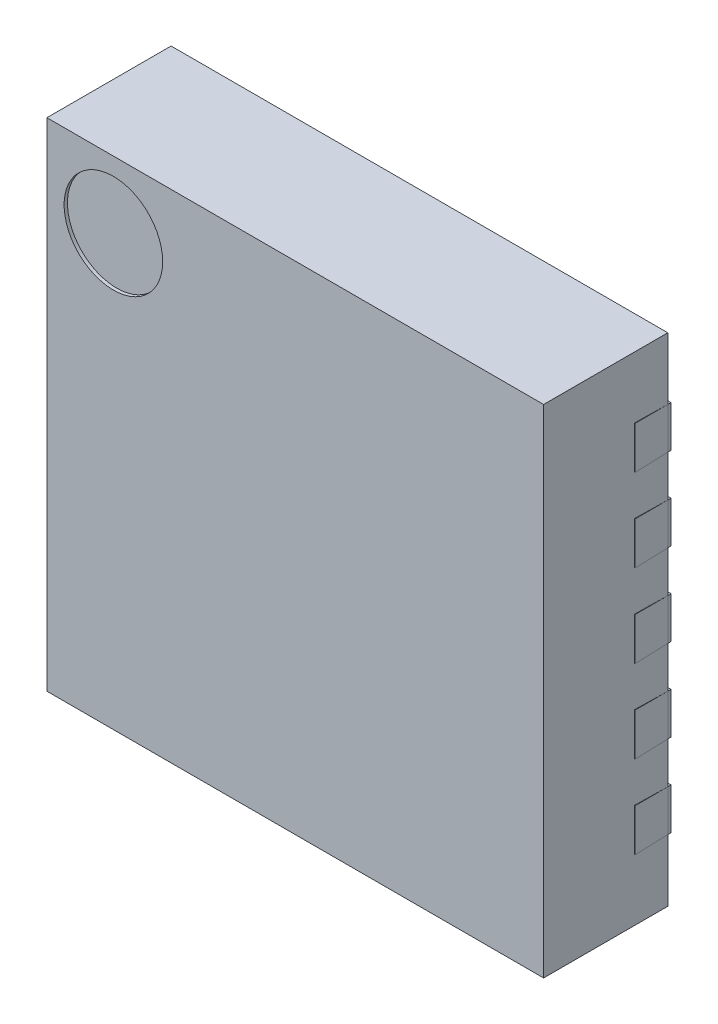
from build123d import *

# Parameters (mm, degrees)
SKETCH1_W                     = 3
SKETCH1_H                     = 3
BOSS_EXTRUDE1_DEPTH           = 0.75
SKETCH2_R                     = 0.297554852
CUT_EXTRUDE1_DEPTH            = 0.02
BOSS_EXTRUDE2_DEPTH           = 0.02
BOSS_EXTRUDE3_DEPTH           = 0.02
BOSS_EXTRUDE3_OTHER_WAY_DEPTH = 0.2
BOSS_EXTRUDE3_OTHER_WAY_DRAFT = 1
LPATTERN2_COUNT               = 3
LPATTERN2_PITCH               = 0.5
LPATTERN2_COPY_1_DEPTH        = 0.2
LPATTERN2_COPY_1_DRAFT        = 1
LPATTERN2_COPY_2_DEPTH        = 0.2
LPATTERN2_COPY_2_DRAFT        = 1
LPATTERN2_COPY_3_DEPTH        = 0.2
LPATTERN2_COPY_3_DRAFT        = 1
LPATTERN2_COPY_4_DEPTH        = 0.2
LPATTERN2_COPY_4_DRAFT        = 1
LPATTERN2_COL_COUNT           = 3
LPATTERN2_COL_PITCH           = 0.5
LPATTERN2_COL_COPY_1_DEPTH    = 0.2
LPATTERN2_COL_COPY_1_DRAFT    = 1
LPATTERN2_COL_COPY_2_DEPTH    = 0.2
LPATTERN2_COL_COPY_2_DRAFT    = 1
LPATTERN2_COL_COPY_3_DEPTH    = 0.2
LPATTERN2_COL_COPY_3_DRAFT    = 1
LPATTERN2_COL_COPY_4_DEPTH    = 0.2
LPATTERN2_COL_COPY_4_DRAFT    = 1
MIRROR1_COPY_1_DEPTH          = 0.2
MIRROR1_COPY_1_DRAFT          = 1
MIRROR1_COPY_2_DEPTH          = 0.2
MIRROR1_COPY_2_DRAFT          = 1
MIRROR1_COPY_3_DEPTH          = 0.02
MIRROR1_COPY_4_DEPTH          = 0.02
MIRROR1_COPY_5_DEPTH          = 0.2
MIRROR1_COPY_5_DRAFT          = 1
MIRROR1_COPY_6_DEPTH          = 0.2
MIRROR1_COPY_6_DRAFT          = 1
MIRROR1_COPY_7_DEPTH          = 0.2
MIRROR1_COPY_7_DRAFT          = 1
MIRROR1_COPY_8_DEPTH          = 0.2
MIRROR1_COPY_8_DRAFT          = 1
MIRROR1_COPY_9_DEPTH          = 0.02
MIRROR1_COPY_10_DEPTH         = 0.02
MIRROR1_COPY_11_DEPTH         = 0.2
MIRROR1_COPY_11_DRAFT         = 1
MIRROR1_COPY_12_DEPTH         = 0.2
MIRROR1_COPY_12_DRAFT         = 1
MIRROR1_COPY_13_DEPTH         = 0.2
MIRROR1_COPY_13_DRAFT         = 1
MIRROR1_COPY_14_DEPTH         = 0.2
MIRROR1_COPY_14_DRAFT         = 1
MIRROR1_COPY_15_DEPTH         = 0.2
MIRROR1_COPY_15_DRAFT         = 1


with BuildPart() as part:
    # Sketch1 → Boss-Extrude1 (new body)
    with BuildSketch(Plane.XY):
        Rectangle(SKETCH1_W, SKETCH1_H)
    extrude(amount=BOSS_EXTRUDE1_DEPTH)

    # Sketch2 → Cut-Extrude1 (cut)
    with BuildSketch(Plane.XY.offset(0.75)):
        with Locations((-1.098438597, 1.096593323)):
            Circle(SKETCH2_R)
    extrude(amount=-CUT_EXTRUDE1_DEPTH, mode=Mode.SUBTRACT)

    # Sketch3 → Boss-Extrude2 (add)
    with BuildSketch(Plane(origin=(0, 0, 0), x_dir=(-1, 0, 0), z_dir=(0, 0, -1))):
        Polygon((0.825, 1.007619321), (0.642619321, 1.19), (-0.825, 1.19), (-0.825, -1.19), (0.825, -1.19), align=None)
    extrude(amount=BOSS_EXTRUDE2_DEPTH)

    # Sketch4 → Boss-Extrude3 (add)
    with BuildSketch(Plane(origin=(0, 0, 0), x_dir=(-1, 0, 0), z_dir=(0, 0, -1))):
        with BuildLine():
            Line((-1.5, 0.125), (-1.5, -0.125))
            Line((-1.5, -0.125), (-1.245, -0.125))
            ThreePointArc((-1.245, -0.125), (-1.12, 0), (-1.245, 0.125))
            Line((-1.245, 0.125), (-1.5, 0.125))
        make_face()
    boss_extrude3 = extrude(amount=BOSS_EXTRUDE3_DEPTH)


with BuildPart() as boss_extrude3_other_way_tool:
    # Sketch4 → Boss-Extrude3 other way (with draft: the straight prism first)
    with BuildSketch(Plane(origin=(0, 0, 0), x_dir=(-1, 0, 0), z_dir=(0, 0, -1))):
        with BuildLine():
            Line((-1.5, 0.125), (-1.5, -0.125))
            Line((-1.5, -0.125), (-1.245, -0.125))
            ThreePointArc((-1.245, -0.125), (-1.12, 0), (-1.245, 0.125))
            Line((-1.245, 0.125), (-1.5, 0.125))
        make_face()
    extrude(amount=-BOSS_EXTRUDE3_OTHER_WAY_DEPTH)
    # Boss-Extrude3 other way: the draft: its side faces are tilted about the plane it starts from
    boss_extrude3_other_way_sides = [boss_extrude3_other_way_tool.faces().sort_by_distance(p)[0] for p in [
        (1.3725, 0.125, 0.1),
        (1.5, 0, 0.1),
        (1.3725, -0.125, 0.1),
        (1.12, 0, 0.1),
    ]]
    draft(boss_extrude3_other_way_sides, Plane(origin=(0, 0, 0), x_dir=(-1, 0, 0), z_dir=(0, 0, -1)), BOSS_EXTRUDE3_OTHER_WAY_DRAFT)


with BuildPart() as part_1:
    add(part.part)

    # Boss-Extrude3 other way: add boss_extrude3_other_way_tool
    add(boss_extrude3_other_way_tool.part)

    # LPattern2: Boss-Extrude3 ×3
    with Locations(*[(0, i * LPATTERN2_PITCH, 0) for i in range(1, LPATTERN2_COUNT)]):
        add(boss_extrude3)


with BuildPart() as lpattern2_copy_1_tool:
    # LPattern2 copy 1 sketch → LPattern2 copy 1 (with draft: the straight prism first)
    with BuildSketch(Plane(origin=(0, 0.5, 0), x_dir=(-1, 0, 0), z_dir=(0, 0, -1))):
        with BuildLine():
            Line((-1.5, 0.125), (-1.5, -0.125))
            Line((-1.5, -0.125), (-1.245, -0.125))
            ThreePointArc((-1.245, -0.125), (-1.12, 0), (-1.245, 0.125))
            Line((-1.245, 0.125), (-1.5, 0.125))
        make_face()
    extrude(amount=-LPATTERN2_COPY_1_DEPTH)
    # LPattern2 copy 1: the draft: its side faces are tilted about the plane it starts from
    lpattern2_copy_1_sides = [lpattern2_copy_1_tool.faces().sort_by_distance(p)[0] for p in [
        (1.3725, 0.625, 0.1),
        (1.5, 0.5, 0.1),
        (1.3725, 0.375, 0.1),
        (1.12, 0.5, 0.1),
    ]]
    draft(lpattern2_copy_1_sides, Plane(origin=(0, 0.5, 0), x_dir=(-1, 0, 0), z_dir=(0, 0, -1)), LPATTERN2_COPY_1_DRAFT)


with BuildPart() as part_2:
    add(part_1.part)

    # LPattern2 copy 1: add lpattern2_copy_1_tool
    add(lpattern2_copy_1_tool.part)


with BuildPart() as lpattern2_copy_2_tool:
    # LPattern2 copy 2 sketch → LPattern2 copy 2 (with draft: the straight prism first)
    with BuildSketch(Plane(origin=(0, 1, 0), x_dir=(-1, 0, 0), z_dir=(0, 0, -1))):
        with BuildLine():
            Line((-1.5, 0.125), (-1.5, -0.125))
            Line((-1.5, -0.125), (-1.245, -0.125))
            ThreePointArc((-1.245, -0.125), (-1.12, 0), (-1.245, 0.125))
            Line((-1.245, 0.125), (-1.5, 0.125))
        make_face()
    extrude(amount=-LPATTERN2_COPY_2_DEPTH)
    # LPattern2 copy 2: the draft: its side faces are tilted about the plane it starts from
    lpattern2_copy_2_sides = [lpattern2_copy_2_tool.faces().sort_by_distance(p)[0] for p in [
        (1.3725, 1.125, 0.1),
        (1.5, 1, 0.1),
        (1.3725, 0.875, 0.1),
        (1.12, 1, 0.1),
    ]]
    draft(lpattern2_copy_2_sides, Plane(origin=(0, 1, 0), x_dir=(-1, 0, 0), z_dir=(0, 0, -1)), LPATTERN2_COPY_2_DRAFT)


with BuildPart() as part_3:
    add(part_2.part)

    # LPattern2 copy 2: add lpattern2_copy_2_tool
    add(lpattern2_copy_2_tool.part)


with BuildPart() as lpattern2_copy_3_tool:
    # LPattern2 copy 3 sketch → LPattern2 copy 3 (with draft: the straight prism first)
    with BuildSketch(Plane(origin=(0, 0.5, 0), x_dir=(-1, 0, 0), z_dir=(0, 0, -1))):
        with BuildLine():
            Line((-1.5, 0.125), (-1.5, -0.125))
            Line((-1.5, -0.125), (-1.245, -0.125))
            ThreePointArc((-1.245, -0.125), (-1.12, 0), (-1.245, 0.125))
            Line((-1.245, 0.125), (-1.5, 0.125))
        make_face()
    extrude(amount=-LPATTERN2_COPY_3_DEPTH)
    # LPattern2 copy 3: the draft: its side faces are tilted about the plane it starts from
    lpattern2_copy_3_sides = [lpattern2_copy_3_tool.faces().sort_by_distance(p)[0] for p in [
        (1.3725, 0.625, 0.1),
        (1.5, 0.5, 0.1),
        (1.3725, 0.375, 0.1),
        (1.12, 0.5, 0.1),
    ]]
    draft(lpattern2_copy_3_sides, Plane(origin=(0, 0.5, 0), x_dir=(-1, 0, 0), z_dir=(0, 0, -1)), LPATTERN2_COPY_3_DRAFT)


with BuildPart() as part_4:
    add(part_3.part)

    # LPattern2 copy 3: add lpattern2_copy_3_tool
    add(lpattern2_copy_3_tool.part)


with BuildPart() as lpattern2_copy_4_tool:
    # LPattern2 copy 4 sketch → LPattern2 copy 4 (with draft: the straight prism first)
    with BuildSketch(Plane(origin=(0, 1, 0), x_dir=(-1, 0, 0), z_dir=(0, 0, -1))):
        with BuildLine():
            Line((-1.5, 0.125), (-1.5, -0.125))
            Line((-1.5, -0.125), (-1.245, -0.125))
            ThreePointArc((-1.245, -0.125), (-1.12, 0), (-1.245, 0.125))
            Line((-1.245, 0.125), (-1.5, 0.125))
        make_face()
    extrude(amount=-LPATTERN2_COPY_4_DEPTH)
    # LPattern2 copy 4: the draft: its side faces are tilted about the plane it starts from
    lpattern2_copy_4_sides = [lpattern2_copy_4_tool.faces().sort_by_distance(p)[0] for p in [
        (1.3725, 1.125, 0.1),
        (1.5, 1, 0.1),
        (1.3725, 0.875, 0.1),
        (1.12, 1, 0.1),
    ]]
    draft(lpattern2_copy_4_sides, Plane(origin=(0, 1, 0), x_dir=(-1, 0, 0), z_dir=(0, 0, -1)), LPATTERN2_COPY_4_DRAFT)


with BuildPart() as part_5:
    add(part_4.part)

    # LPattern2 copy 4: add lpattern2_copy_4_tool
    add(lpattern2_copy_4_tool.part)

    # LPattern2 col: Boss-Extrude3 ×3
    with Locations(*[(0, -i * LPATTERN2_COL_PITCH, 0) for i in range(1, LPATTERN2_COL_COUNT)]):
        add(boss_extrude3)


with BuildPart() as lpattern2_col_copy_1_tool:
    # LPattern2 col copy 1 sketch → LPattern2 col copy 1 (with draft: the straight prism first)
    with BuildSketch(Plane(origin=(0, -0.5, 0), x_dir=(-1, 0, 0), z_dir=(0, 0, -1))):
        with BuildLine():
            Line((-1.5, 0.125), (-1.5, -0.125))
            Line((-1.5, -0.125), (-1.245, -0.125))
            ThreePointArc((-1.245, -0.125), (-1.12, 0), (-1.245, 0.125))
            Line((-1.245, 0.125), (-1.5, 0.125))
        make_face()
    extrude(amount=-LPATTERN2_COL_COPY_1_DEPTH)
    # LPattern2 col copy 1: the draft: its side faces are tilted about the plane it starts from
    lpattern2_col_copy_1_sides = [lpattern2_col_copy_1_tool.faces().sort_by_distance(p)[0] for p in [
        (1.3725, -0.375, 0.1),
        (1.5, -0.5, 0.1),
        (1.3725, -0.625, 0.1),
        (1.12, -0.5, 0.1),
    ]]
    draft(lpattern2_col_copy_1_sides, Plane(origin=(0, -0.5, 0), x_dir=(-1, 0, 0), z_dir=(0, 0, -1)), LPATTERN2_COL_COPY_1_DRAFT)


with BuildPart() as part_6:
    add(part_5.part)

    # LPattern2 col copy 1: add lpattern2_col_copy_1_tool
    add(lpattern2_col_copy_1_tool.part)


with BuildPart() as lpattern2_col_copy_2_tool:
    # LPattern2 col copy 2 sketch → LPattern2 col copy 2 (with draft: the straight prism first)
    with BuildSketch(Plane(origin=(0, -1, 0), x_dir=(-1, 0, 0), z_dir=(0, 0, -1))):
        with BuildLine():
            Line((-1.5, 0.125), (-1.5, -0.125))
            Line((-1.5, -0.125), (-1.245, -0.125))
            ThreePointArc((-1.245, -0.125), (-1.12, 0), (-1.245, 0.125))
            Line((-1.245, 0.125), (-1.5, 0.125))
        make_face()
    extrude(amount=-LPATTERN2_COL_COPY_2_DEPTH)
    # LPattern2 col copy 2: the draft: its side faces are tilted about the plane it starts from
    lpattern2_col_copy_2_sides = [lpattern2_col_copy_2_tool.faces().sort_by_distance(p)[0] for p in [
        (1.3725, -0.875, 0.1),
        (1.5, -1, 0.1),
        (1.3725, -1.125, 0.1),
        (1.12, -1, 0.1),
    ]]
    draft(lpattern2_col_copy_2_sides, Plane(origin=(0, -1, 0), x_dir=(-1, 0, 0), z_dir=(0, 0, -1)), LPATTERN2_COL_COPY_2_DRAFT)


with BuildPart() as part_7:
    add(part_6.part)

    # LPattern2 col copy 2: add lpattern2_col_copy_2_tool
    add(lpattern2_col_copy_2_tool.part)


with BuildPart() as lpattern2_col_copy_3_tool:
    # LPattern2 col copy 3 sketch → LPattern2 col copy 3 (with draft: the straight prism first)
    with BuildSketch(Plane(origin=(0, -0.5, 0), x_dir=(-1, 0, 0), z_dir=(0, 0, -1))):
        with BuildLine():
            Line((-1.5, 0.125), (-1.5, -0.125))
            Line((-1.5, -0.125), (-1.245, -0.125))
            ThreePointArc((-1.245, -0.125), (-1.12, 0), (-1.245, 0.125))
            Line((-1.245, 0.125), (-1.5, 0.125))
        make_face()
    extrude(amount=-LPATTERN2_COL_COPY_3_DEPTH)
    # LPattern2 col copy 3: the draft: its side faces are tilted about the plane it starts from
    lpattern2_col_copy_3_sides = [lpattern2_col_copy_3_tool.faces().sort_by_distance(p)[0] for p in [
        (1.3725, -0.375, 0.1),
        (1.5, -0.5, 0.1),
        (1.3725, -0.625, 0.1),
        (1.12, -0.5, 0.1),
    ]]
    draft(lpattern2_col_copy_3_sides, Plane(origin=(0, -0.5, 0), x_dir=(-1, 0, 0), z_dir=(0, 0, -1)), LPATTERN2_COL_COPY_3_DRAFT)


with BuildPart() as part_8:
    add(part_7.part)

    # LPattern2 col copy 3: add lpattern2_col_copy_3_tool
    add(lpattern2_col_copy_3_tool.part)


with BuildPart() as lpattern2_col_copy_4_tool:
    # LPattern2 col copy 4 sketch → LPattern2 col copy 4 (with draft: the straight prism first)
    with BuildSketch(Plane(origin=(0, -1, 0), x_dir=(-1, 0, 0), z_dir=(0, 0, -1))):
        with BuildLine():
            Line((-1.5, 0.125), (-1.5, -0.125))
            Line((-1.5, -0.125), (-1.245, -0.125))
            ThreePointArc((-1.245, -0.125), (-1.12, 0), (-1.245, 0.125))
            Line((-1.245, 0.125), (-1.5, 0.125))
        make_face()
    extrude(amount=-LPATTERN2_COL_COPY_4_DEPTH)
    # LPattern2 col copy 4: the draft: its side faces are tilted about the plane it starts from
    lpattern2_col_copy_4_sides = [lpattern2_col_copy_4_tool.faces().sort_by_distance(p)[0] for p in [
        (1.3725, -0.875, 0.1),
        (1.5, -1, 0.1),
        (1.3725, -1.125, 0.1),
        (1.12, -1, 0.1),
    ]]
    draft(lpattern2_col_copy_4_sides, Plane(origin=(0, -1, 0), x_dir=(-1, 0, 0), z_dir=(0, 0, -1)), LPATTERN2_COL_COPY_4_DRAFT)


with BuildPart() as part_9:
    add(part_8.part)

    # LPattern2 col copy 4: add lpattern2_col_copy_4_tool
    add(lpattern2_col_copy_4_tool.part)

    # Mirror1: Boss-Extrude3 across plane
    add(boss_extrude3.mirror(Plane(origin=(0, 0, 0), x_dir=(0, 0, 1), z_dir=(1, 0, 0))))


with BuildPart() as mirror1_copy_1_tool:
    # Mirror1 copy 1 sketch → Mirror1 copy 1 (with draft: the straight prism first)
    with BuildSketch(Plane(origin=(0, 0, 0), x_dir=(1, 0, 0), z_dir=(0, 0, -1))):
        with BuildLine():
            Line((-1.5, -0.125), (-1.5, 0.125))
            Line((-1.5, 0.125), (-1.245, 0.125))
            ThreePointArc((-1.245, 0.125), (-1.12, 0), (-1.245, -0.125))
            Line((-1.245, -0.125), (-1.5, -0.125))
        make_face()
    extrude(amount=-MIRROR1_COPY_1_DEPTH)
    # Mirror1 copy 1: the draft: its side faces are tilted about the plane it starts from
    mirror1_copy_1_sides = [mirror1_copy_1_tool.faces().sort_by_distance(p)[0] for p in [
        (-1.3725, 0.125, 0.1),
        (-1.5, 0, 0.1),
        (-1.3725, -0.125, 0.1),
        (-1.12, 0, 0.1),
    ]]
    draft(mirror1_copy_1_sides, Plane(origin=(0, 0, 0), x_dir=(1, 0, 0), z_dir=(0, 0, -1)), MIRROR1_COPY_1_DRAFT)


with BuildPart() as part_10:
    add(part_9.part)

    # Mirror1 copy 1: add mirror1_copy_1_tool
    add(mirror1_copy_1_tool.part)


with BuildPart() as mirror1_copy_2_tool:
    # Mirror1 copy 2 sketch → Mirror1 copy 2 (with draft: the straight prism first)
    with BuildSketch(Plane(origin=(0, 0, 0), x_dir=(1, 0, 0), z_dir=(0, 0, -1))):
        with BuildLine():
            Line((-1.5, -0.125), (-1.5, 0.125))
            Line((-1.5, 0.125), (-1.245, 0.125))
            ThreePointArc((-1.245, 0.125), (-1.12, 0), (-1.245, -0.125))
            Line((-1.245, -0.125), (-1.5, -0.125))
        make_face()
    extrude(amount=-MIRROR1_COPY_2_DEPTH)
    # Mirror1 copy 2: the draft: its side faces are tilted about the plane it starts from
    mirror1_copy_2_sides = [mirror1_copy_2_tool.faces().sort_by_distance(p)[0] for p in [
        (-1.3725, 0.125, 0.1),
        (-1.5, 0, 0.1),
        (-1.3725, -0.125, 0.1),
        (-1.12, 0, 0.1),
    ]]
    draft(mirror1_copy_2_sides, Plane(origin=(0, 0, 0), x_dir=(1, 0, 0), z_dir=(0, 0, -1)), MIRROR1_COPY_2_DRAFT)


with BuildPart() as part_11:
    add(part_10.part)

    # Mirror1 copy 2: add mirror1_copy_2_tool
    add(mirror1_copy_2_tool.part)

    # Mirror1 copy 3 sketch → Mirror1 copy 3 (add)
    with BuildSketch(Plane(origin=(0, 0.5, 0), x_dir=(1, 0, 0), z_dir=(0, 0, -1))):
        with BuildLine():
            Line((-1.5, -0.125), (-1.5, 0.125))
            Line((-1.5, 0.125), (-1.245, 0.125))
            ThreePointArc((-1.245, 0.125), (-1.12, 0), (-1.245, -0.125))
            Line((-1.245, -0.125), (-1.5, -0.125))
        make_face()
    extrude(amount=MIRROR1_COPY_3_DEPTH)

    # Mirror1 copy 4 sketch → Mirror1 copy 4 (add)
    with BuildSketch(Plane(origin=(0, 1, 0), x_dir=(1, 0, 0), z_dir=(0, 0, -1))):
        with BuildLine():
            Line((-1.5, -0.125), (-1.5, 0.125))
            Line((-1.5, 0.125), (-1.245, 0.125))
            ThreePointArc((-1.245, 0.125), (-1.12, 0), (-1.245, -0.125))
            Line((-1.245, -0.125), (-1.5, -0.125))
        make_face()
    extrude(amount=MIRROR1_COPY_4_DEPTH)


with BuildPart() as mirror1_copy_5_tool:
    # Mirror1 copy 5 sketch → Mirror1 copy 5 (with draft: the straight prism first)
    with BuildSketch(Plane(origin=(0, 0.5, 0), x_dir=(1, 0, 0), z_dir=(0, 0, -1))):
        with BuildLine():
            Line((-1.5, -0.125), (-1.5, 0.125))
            Line((-1.5, 0.125), (-1.245, 0.125))
            ThreePointArc((-1.245, 0.125), (-1.12, 0), (-1.245, -0.125))
            Line((-1.245, -0.125), (-1.5, -0.125))
        make_face()
    extrude(amount=-MIRROR1_COPY_5_DEPTH)
    # Mirror1 copy 5: the draft: its side faces are tilted about the plane it starts from
    mirror1_copy_5_sides = [mirror1_copy_5_tool.faces().sort_by_distance(p)[0] for p in [
        (-1.3725, 0.625, 0.1),
        (-1.5, 0.5, 0.1),
        (-1.3725, 0.375, 0.1),
        (-1.12, 0.5, 0.1),
    ]]
    draft(mirror1_copy_5_sides, Plane(origin=(0, 0.5, 0), x_dir=(1, 0, 0), z_dir=(0, 0, -1)), MIRROR1_COPY_5_DRAFT)


with BuildPart() as part_12:
    add(part_11.part)

    # Mirror1 copy 5: add mirror1_copy_5_tool
    add(mirror1_copy_5_tool.part)


with BuildPart() as mirror1_copy_6_tool:
    # Mirror1 copy 6 sketch → Mirror1 copy 6 (with draft: the straight prism first)
    with BuildSketch(Plane(origin=(0, 1, 0), x_dir=(1, 0, 0), z_dir=(0, 0, -1))):
        with BuildLine():
            Line((-1.5, -0.125), (-1.5, 0.125))
            Line((-1.5, 0.125), (-1.245, 0.125))
            ThreePointArc((-1.245, 0.125), (-1.12, 0), (-1.245, -0.125))
            Line((-1.245, -0.125), (-1.5, -0.125))
        make_face()
    extrude(amount=-MIRROR1_COPY_6_DEPTH)
    # Mirror1 copy 6: the draft: its side faces are tilted about the plane it starts from
    mirror1_copy_6_sides = [mirror1_copy_6_tool.faces().sort_by_distance(p)[0] for p in [
        (-1.3725, 1.125, 0.1),
        (-1.5, 1, 0.1),
        (-1.3725, 0.875, 0.1),
        (-1.12, 1, 0.1),
    ]]
    draft(mirror1_copy_6_sides, Plane(origin=(0, 1, 0), x_dir=(1, 0, 0), z_dir=(0, 0, -1)), MIRROR1_COPY_6_DRAFT)


with BuildPart() as part_13:
    add(part_12.part)

    # Mirror1 copy 6: add mirror1_copy_6_tool
    add(mirror1_copy_6_tool.part)


with BuildPart() as mirror1_copy_7_tool:
    # Mirror1 copy 7 sketch → Mirror1 copy 7 (with draft: the straight prism first)
    with BuildSketch(Plane(origin=(0, 0.5, 0), x_dir=(1, 0, 0), z_dir=(0, 0, -1))):
        with BuildLine():
            Line((-1.5, -0.125), (-1.5, 0.125))
            Line((-1.5, 0.125), (-1.245, 0.125))
            ThreePointArc((-1.245, 0.125), (-1.12, 0), (-1.245, -0.125))
            Line((-1.245, -0.125), (-1.5, -0.125))
        make_face()
    extrude(amount=-MIRROR1_COPY_7_DEPTH)
    # Mirror1 copy 7: the draft: its side faces are tilted about the plane it starts from
    mirror1_copy_7_sides = [mirror1_copy_7_tool.faces().sort_by_distance(p)[0] for p in [
        (-1.3725, 0.625, 0.1),
        (-1.5, 0.5, 0.1),
        (-1.3725, 0.375, 0.1),
        (-1.12, 0.5, 0.1),
    ]]
    draft(mirror1_copy_7_sides, Plane(origin=(0, 0.5, 0), x_dir=(1, 0, 0), z_dir=(0, 0, -1)), MIRROR1_COPY_7_DRAFT)


with BuildPart() as part_14:
    add(part_13.part)

    # Mirror1 copy 7: add mirror1_copy_7_tool
    add(mirror1_copy_7_tool.part)


with BuildPart() as mirror1_copy_8_tool:
    # Mirror1 copy 8 sketch → Mirror1 copy 8 (with draft: the straight prism first)
    with BuildSketch(Plane(origin=(0, 1, 0), x_dir=(1, 0, 0), z_dir=(0, 0, -1))):
        with BuildLine():
            Line((-1.5, -0.125), (-1.5, 0.125))
            Line((-1.5, 0.125), (-1.245, 0.125))
            ThreePointArc((-1.245, 0.125), (-1.12, 0), (-1.245, -0.125))
            Line((-1.245, -0.125), (-1.5, -0.125))
        make_face()
    extrude(amount=-MIRROR1_COPY_8_DEPTH)
    # Mirror1 copy 8: the draft: its side faces are tilted about the plane it starts from
    mirror1_copy_8_sides = [mirror1_copy_8_tool.faces().sort_by_distance(p)[0] for p in [
        (-1.3725, 1.125, 0.1),
        (-1.5, 1, 0.1),
        (-1.3725, 0.875, 0.1),
        (-1.12, 1, 0.1),
    ]]
    draft(mirror1_copy_8_sides, Plane(origin=(0, 1, 0), x_dir=(1, 0, 0), z_dir=(0, 0, -1)), MIRROR1_COPY_8_DRAFT)


with BuildPart() as part_15:
    add(part_14.part)

    # Mirror1 copy 8: add mirror1_copy_8_tool
    add(mirror1_copy_8_tool.part)

    # Mirror1 copy 9 sketch → Mirror1 copy 9 (add)
    with BuildSketch(Plane(origin=(0, -0.5, 0), x_dir=(1, 0, 0), z_dir=(0, 0, -1))):
        with BuildLine():
            Line((-1.5, -0.125), (-1.5, 0.125))
            Line((-1.5, 0.125), (-1.245, 0.125))
            ThreePointArc((-1.245, 0.125), (-1.12, 0), (-1.245, -0.125))
            Line((-1.245, -0.125), (-1.5, -0.125))
        make_face()
    extrude(amount=MIRROR1_COPY_9_DEPTH)

    # Mirror1 copy 10 sketch → Mirror1 copy 10 (add)
    with BuildSketch(Plane(origin=(0, -1, 0), x_dir=(1, 0, 0), z_dir=(0, 0, -1))):
        with BuildLine():
            Line((-1.5, -0.125), (-1.5, 0.125))
            Line((-1.5, 0.125), (-1.245, 0.125))
            ThreePointArc((-1.245, 0.125), (-1.12, 0), (-1.245, -0.125))
            Line((-1.245, -0.125), (-1.5, -0.125))
        make_face()
    extrude(amount=MIRROR1_COPY_10_DEPTH)


with BuildPart() as mirror1_copy_11_tool:
    # Mirror1 copy 11 sketch → Mirror1 copy 11 (with draft: the straight prism first)
    with BuildSketch(Plane(origin=(0, -0.5, 0), x_dir=(1, 0, 0), z_dir=(0, 0, -1))):
        with BuildLine():
            Line((-1.5, -0.125), (-1.5, 0.125))
            Line((-1.5, 0.125), (-1.245, 0.125))
            ThreePointArc((-1.245, 0.125), (-1.12, 0), (-1.245, -0.125))
            Line((-1.245, -0.125), (-1.5, -0.125))
        make_face()
    extrude(amount=-MIRROR1_COPY_11_DEPTH)
    # Mirror1 copy 11: the draft: its side faces are tilted about the plane it starts from
    mirror1_copy_11_sides = [mirror1_copy_11_tool.faces().sort_by_distance(p)[0] for p in [
        (-1.3725, -0.375, 0.1),
        (-1.5, -0.5, 0.1),
        (-1.3725, -0.625, 0.1),
        (-1.12, -0.5, 0.1),
    ]]
    draft(mirror1_copy_11_sides, Plane(origin=(0, -0.5, 0), x_dir=(1, 0, 0), z_dir=(0, 0, -1)), MIRROR1_COPY_11_DRAFT)


with BuildPart() as part_16:
    add(part_15.part)

    # Mirror1 copy 11: add mirror1_copy_11_tool
    add(mirror1_copy_11_tool.part)


with BuildPart() as mirror1_copy_12_tool:
    # Mirror1 copy 12 sketch → Mirror1 copy 12 (with draft: the straight prism first)
    with BuildSketch(Plane(origin=(0, -1, 0), x_dir=(1, 0, 0), z_dir=(0, 0, -1))):
        with BuildLine():
            Line((-1.5, -0.125), (-1.5, 0.125))
            Line((-1.5, 0.125), (-1.245, 0.125))
            ThreePointArc((-1.245, 0.125), (-1.12, 0), (-1.245, -0.125))
            Line((-1.245, -0.125), (-1.5, -0.125))
        make_face()
    extrude(amount=-MIRROR1_COPY_12_DEPTH)
    # Mirror1 copy 12: the draft: its side faces are tilted about the plane it starts from
    mirror1_copy_12_sides = [mirror1_copy_12_tool.faces().sort_by_distance(p)[0] for p in [
        (-1.3725, -0.875, 0.1),
        (-1.5, -1, 0.1),
        (-1.3725, -1.125, 0.1),
        (-1.12, -1, 0.1),
    ]]
    draft(mirror1_copy_12_sides, Plane(origin=(0, -1, 0), x_dir=(1, 0, 0), z_dir=(0, 0, -1)), MIRROR1_COPY_12_DRAFT)


with BuildPart() as part_17:
    add(part_16.part)

    # Mirror1 copy 12: add mirror1_copy_12_tool
    add(mirror1_copy_12_tool.part)


with BuildPart() as mirror1_copy_13_tool:
    # Mirror1 copy 13 sketch → Mirror1 copy 13 (with draft: the straight prism first)
    with BuildSketch(Plane(origin=(0, -0.5, 0), x_dir=(1, 0, 0), z_dir=(0, 0, -1))):
        with BuildLine():
            Line((-1.5, -0.125), (-1.5, 0.125))
            Line((-1.5, 0.125), (-1.245, 0.125))
            ThreePointArc((-1.245, 0.125), (-1.12, 0), (-1.245, -0.125))
            Line((-1.245, -0.125), (-1.5, -0.125))
        make_face()
    extrude(amount=-MIRROR1_COPY_13_DEPTH)
    # Mirror1 copy 13: the draft: its side faces are tilted about the plane it starts from
    mirror1_copy_13_sides = [mirror1_copy_13_tool.faces().sort_by_distance(p)[0] for p in [
        (-1.3725, -0.375, 0.1),
        (-1.5, -0.5, 0.1),
        (-1.3725, -0.625, 0.1),
        (-1.12, -0.5, 0.1),
    ]]
    draft(mirror1_copy_13_sides, Plane(origin=(0, -0.5, 0), x_dir=(1, 0, 0), z_dir=(0, 0, -1)), MIRROR1_COPY_13_DRAFT)


with BuildPart() as part_18:
    add(part_17.part)

    # Mirror1 copy 13: add mirror1_copy_13_tool
    add(mirror1_copy_13_tool.part)


with BuildPart() as mirror1_copy_14_tool:
    # Mirror1 copy 14 sketch → Mirror1 copy 14 (with draft: the straight prism first)
    with BuildSketch(Plane(origin=(0, -1, 0), x_dir=(1, 0, 0), z_dir=(0, 0, -1))):
        with BuildLine():
            Line((-1.5, -0.125), (-1.5, 0.125))
            Line((-1.5, 0.125), (-1.245, 0.125))
            ThreePointArc((-1.245, 0.125), (-1.12, 0), (-1.245, -0.125))
            Line((-1.245, -0.125), (-1.5, -0.125))
        make_face()
    extrude(amount=-MIRROR1_COPY_14_DEPTH)
    # Mirror1 copy 14: the draft: its side faces are tilted about the plane it starts from
    mirror1_copy_14_sides = [mirror1_copy_14_tool.faces().sort_by_distance(p)[0] for p in [
        (-1.3725, -0.875, 0.1),
        (-1.5, -1, 0.1),
        (-1.3725, -1.125, 0.1),
        (-1.12, -1, 0.1),
    ]]
    draft(mirror1_copy_14_sides, Plane(origin=(0, -1, 0), x_dir=(1, 0, 0), z_dir=(0, 0, -1)), MIRROR1_COPY_14_DRAFT)


with BuildPart() as part_19:
    add(part_18.part)

    # Mirror1 copy 14: add mirror1_copy_14_tool
    add(mirror1_copy_14_tool.part)


with BuildPart() as mirror1_copy_15_tool:
    # Mirror1 copy 15 sketch → Mirror1 copy 15 (with draft: the straight prism first)
    with BuildSketch(Plane(origin=(0, 0, 0), x_dir=(1, 0, 0), z_dir=(0, 0, -1))):
        with BuildLine():
            Line((-1.5, -0.125), (-1.5, 0.125))
            Line((-1.5, 0.125), (-1.245, 0.125))
            ThreePointArc((-1.245, 0.125), (-1.12, 0), (-1.245, -0.125))
            Line((-1.245, -0.125), (-1.5, -0.125))
        make_face()
    extrude(amount=-MIRROR1_COPY_15_DEPTH)
    # Mirror1 copy 15: the draft: its side faces are tilted about the plane it starts from
    mirror1_copy_15_sides = [mirror1_copy_15_tool.faces().sort_by_distance(p)[0] for p in [
        (-1.3725, 0.125, 0.1),
        (-1.5, 0, 0.1),
        (-1.3725, -0.125, 0.1),
        (-1.12, 0, 0.1),
    ]]
    draft(mirror1_copy_15_sides, Plane(origin=(0, 0, 0), x_dir=(1, 0, 0), z_dir=(0, 0, -1)), MIRROR1_COPY_15_DRAFT)


with BuildPart() as part_20:
    add(part_19.part)

    # Mirror1 copy 15: add mirror1_copy_15_tool
    add(mirror1_copy_15_tool.part)


solid = part_20.part
